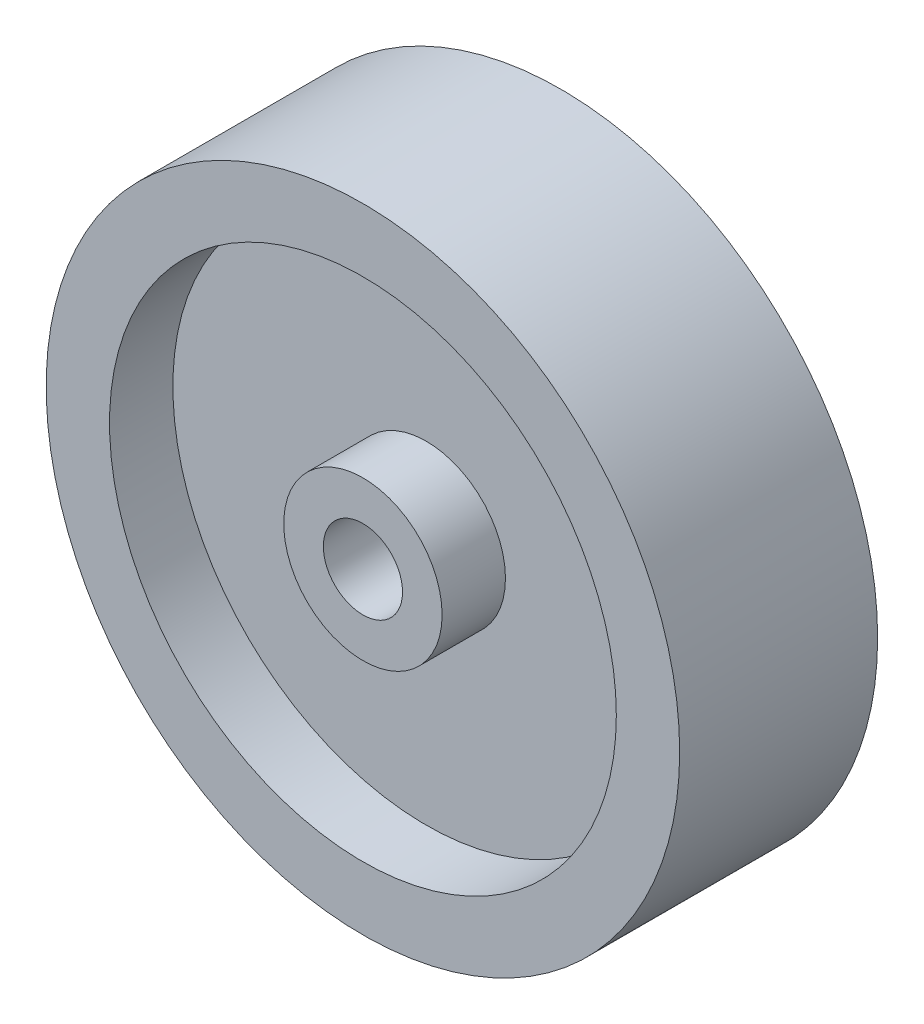
from build123d import *

# Parameters (mm, degrees)
SKETCH1_R           = 50.8
SKETCH1_R_2         = 6.35
BOSS_EXTRUDE1_DEPTH = 15.875
SKETCH2_R           = 40.64
SKETCH2_R_2         = 12.7
CUT_EXTRUDE1_DEPTH  = 10.16


with BuildPart() as part:
    # Sketch1 → Boss-Extrude1 (new, symmetric)
    with BuildSketch(Plane.XY):
        Circle(SKETCH1_R)
        Circle(SKETCH1_R_2, mode=Mode.SUBTRACT)
    extrude(amount=BOSS_EXTRUDE1_DEPTH, both=True)

    # Sketch2 → Cut-Extrude1 (cut)
    with BuildSketch(Plane.XY.offset(15.875)):
        Circle(SKETCH2_R)
        Circle(SKETCH2_R_2, mode=Mode.SUBTRACT)
    cut_extrude1 = extrude(amount=-CUT_EXTRUDE1_DEPTH, mode=Mode.SUBTRACT)

    # Mirror1: Cut-Extrude1 across plane
    add(cut_extrude1.mirror(Plane.XY), mode=Mode.SUBTRACT)


solid = part.part
